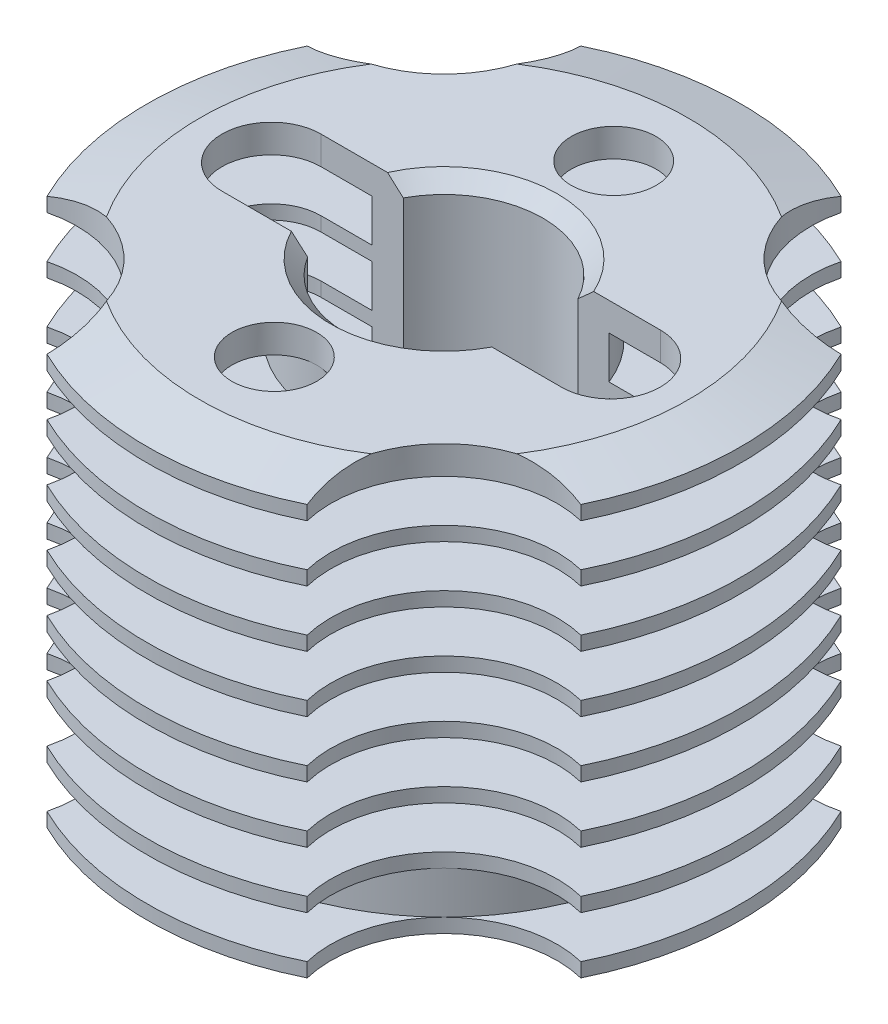
from build123d import *

# Parameters (mm, degrees)
SKETCH1_R            = 21
BOSS_EXTRUDE1_DEPTH  = 1
SKETCH2_R            = 16
BOSS_EXTRUDE2_DEPTH  = 3
SKETCH3_R            = 21
BOSS_EXTRUDE3_DEPTH  = 1
SKETCH4_R            = 9
BOSS_EXTRUDE4_DEPTH  = 3
SKETCH5_R            = 21
BOSS_EXTRUDE5_DEPTH  = 1
SKETCH6_R            = 9
BOSS_EXTRUDE6_DEPTH  = 3
SKETCH7_R            = 21
BOSS_EXTRUDE7_DEPTH  = 1
SKETCH8_R            = 9
BOSS_EXTRUDE8_DEPTH  = 3
SKETCH9_R            = 21
BOSS_EXTRUDE9_DEPTH  = 1
SKETCH10_R           = 9
BOSS_EXTRUDE10_DEPTH = 3
SKETCH11_R           = 21
BOSS_EXTRUDE11_DEPTH = 1
SKETCH12_R           = 9
BOSS_EXTRUDE12_DEPTH = 3
SKETCH13_R           = 21
BOSS_EXTRUDE13_DEPTH = 1
SKETCH14_R           = 9
BOSS_EXTRUDE14_DEPTH = 3
SKETCH15_R           = 21
BOSS_EXTRUDE15_DEPTH = 2
SKETCH16_R           = 7
CUT_EXTRUDE1_DEPTH   = 26
CUT_EXTRUDE2_DEPTH   = 25
SKETCH18_R           = 3
CUT_EXTRUDE3_DEPTH   = 24
SKETCH19_R           = 1.5
CUT_EXTRUDE4_DEPTH   = 39.820097888
CIRPATTERN1_COUNT    = 4
SKETCH23_R           = 7.5
BOSS_EXTRUDE16_DEPTH = 2
SKETCH24_R           = 2.5
CUT_EXTRUDE7_DEPTH   = 44.657759906
CHAMFER4_SIZE        = 1
CHAMFER5_SIZE        = 1
CHAMFER6_SIZE        = 1
CHAMFER6_SIZE2       = 3.732050808
SKETCH26_R           = 8
CUT_EXTRUDE8_DEPTH   = 44.657759906
CIRPATTERN2_COUNT    = 4


with BuildPart() as part:
    # Sketch1 → Boss-Extrude1 (new body)
    with BuildSketch(Plane(origin=(0, 0, 0), x_dir=(1, 0, 0), z_dir=(0, 1, 0))):
        with Locations(Location((0, 0, 0), (0, 0, 270))):
            Circle(SKETCH1_R)
    extrude(amount=BOSS_EXTRUDE1_DEPTH)

    # Sketch2 → Boss-Extrude2 (add)
    with BuildSketch(Plane(origin=(0, 1, 0), x_dir=(1, 0, 0), z_dir=(0, 1, 0))):
        with Locations(Location((0, 0, 0), (0, 0, 270))):
            Circle(SKETCH2_R)
    extrude(amount=BOSS_EXTRUDE2_DEPTH)

    # Sketch3 → Boss-Extrude3 (add)
    with BuildSketch(Plane(origin=(0, 4, 0), x_dir=(1, 0, 0), z_dir=(0, 1, 0))):
        with Locations(Location((0, 0, 0), (0, 0, 270))):
            Circle(SKETCH3_R)
    extrude(amount=BOSS_EXTRUDE3_DEPTH)

    # Sketch4 → Boss-Extrude4 (add)
    with BuildSketch(Plane(origin=(0, 5, 0), x_dir=(1, 0, 0), z_dir=(0, 1, 0))):
        with Locations(Location((0, 0, 0), (0, 0, 270))):
            Circle(SKETCH4_R)
    extrude(amount=BOSS_EXTRUDE4_DEPTH)

    # Sketch5 → Boss-Extrude5 (add)
    with BuildSketch(Plane(origin=(0, 8, 0), x_dir=(1, 0, 0), z_dir=(0, 1, 0))):
        with Locations(Location((0, 0, 0), (0, 0, 270))):
            Circle(SKETCH5_R)
    extrude(amount=BOSS_EXTRUDE5_DEPTH)

    # Sketch6 → Boss-Extrude6 (add)
    with BuildSketch(Plane(origin=(0, 9, 0), x_dir=(1, 0, 0), z_dir=(0, 1, 0))):
        with Locations(Location((0, 0, 0), (0, 0, 270))):
            Circle(SKETCH6_R)
    extrude(amount=BOSS_EXTRUDE6_DEPTH)

    # Sketch7 → Boss-Extrude7 (add)
    with BuildSketch(Plane(origin=(0, 12, 0), x_dir=(1, 0, 0), z_dir=(0, 1, 0))):
        with Locations(Location((0, 0, 0), (0, 0, 270))):
            Circle(SKETCH7_R)
    extrude(amount=BOSS_EXTRUDE7_DEPTH)

    # Sketch8 → Boss-Extrude8 (add)
    with BuildSketch(Plane(origin=(0, 13, 0), x_dir=(1, 0, 0), z_dir=(0, 1, 0))):
        with Locations(Location((0, 0, 0), (0, 0, 270))):
            Circle(SKETCH8_R)
    extrude(amount=BOSS_EXTRUDE8_DEPTH)

    # Sketch9 → Boss-Extrude9 (add)
    with BuildSketch(Plane(origin=(0, 16, 0), x_dir=(1, 0, 0), z_dir=(0, 1, 0))):
        with Locations(Location((0, 0, 0), (0, 0, 270))):
            Circle(SKETCH9_R)
    extrude(amount=BOSS_EXTRUDE9_DEPTH)

    # Sketch10 → Boss-Extrude10 (add)
    with BuildSketch(Plane(origin=(0, 17, 0), x_dir=(1, 0, 0), z_dir=(0, 1, 0))):
        with Locations(Location((0, 0, 0), (0, 0, 270))):
            Circle(SKETCH10_R)
    extrude(amount=BOSS_EXTRUDE10_DEPTH)

    # Sketch11 → Boss-Extrude11 (add)
    with BuildSketch(Plane(origin=(0, 20, 0), x_dir=(1, 0, 0), z_dir=(0, 1, 0))):
        with Locations(Location((0, 0, 0), (0, 0, 270))):
            Circle(SKETCH11_R)
    extrude(amount=BOSS_EXTRUDE11_DEPTH)

    # Sketch12 → Boss-Extrude12 (add)
    with BuildSketch(Plane(origin=(0, 21, 0), x_dir=(1, 0, 0), z_dir=(0, 1, 0))):
        with Locations(Location((0, 0, 0), (0, 0, 270))):
            Circle(SKETCH12_R)
    extrude(amount=BOSS_EXTRUDE12_DEPTH)

    # Sketch13 → Boss-Extrude13 (add)
    with BuildSketch(Plane(origin=(0, 24, 0), x_dir=(1, 0, 0), z_dir=(0, 1, 0))):
        with Locations(Location((0, 0, 0), (0, 0, 270))):
            Circle(SKETCH13_R)
    extrude(amount=BOSS_EXTRUDE13_DEPTH)

    # Sketch14 → Boss-Extrude14 (add)
    with BuildSketch(Plane(origin=(0, 25, 0), x_dir=(1, 0, 0), z_dir=(0, 1, 0))):
        with Locations(Location((0, 0, 0), (0, 0, 270))):
            Circle(SKETCH14_R)
    extrude(amount=BOSS_EXTRUDE14_DEPTH)

    # Sketch15 → Boss-Extrude15 (add)
    with BuildSketch(Plane(origin=(0, 28, 0), x_dir=(1, 0, 0), z_dir=(0, 1, 0))):
        with Locations(Location((0, 0, 0), (0, 0, 270))):
            Circle(SKETCH15_R)
    extrude(amount=BOSS_EXTRUDE15_DEPTH)

    # Sketch16 → Cut-Extrude1 (cut)
    with BuildSketch(Plane(origin=(0, 30, 0), x_dir=(1, 0, 0), z_dir=(0, 1, 0))):
        with Locations(Location((0, 0, 0), (0, 0, 270))):
            Circle(SKETCH16_R)
    extrude(amount=-CUT_EXTRUDE1_DEPTH, mode=Mode.SUBTRACT)

    # Sketch17 → Cut-Extrude2 (cut)
    with BuildSketch(Plane(origin=(0, 30, 0), x_dir=(1, 0, 0), z_dir=(0, 1, 0))):
        with BuildLine():
            Line((12, -3.702439688), (-12, -3.702439688))
            ThreePointArc((-12, -3.702439688), (-15.5, -0.202439688), (-12, 3.297560312))
            Line((-12, 3.297560312), (12, 3.297560312))
            ThreePointArc((12, 3.297560312), (15.5, -0.202439688), (12, -3.702439688))
        make_face()
    extrude(amount=-CUT_EXTRUDE2_DEPTH, mode=Mode.SUBTRACT)

    # Sketch18 → Cut-Extrude3 (cut)
    with BuildSketch(Plane(origin=(0, 30, 0), x_dir=(1, 0, 0), z_dir=(0, 1, 0))):
        with Locations(Location((0, 12, 0), (0, 0, 270))):
            Circle(SKETCH18_R)
        with Locations(Location((0, -12, 0), (0, 0, 270))):
            Circle(SKETCH18_R)
    extrude(amount=-CUT_EXTRUDE3_DEPTH, mode=Mode.SUBTRACT)

    # Sketch19 → Cut-Extrude4 (cut, through all)
    with BuildSketch(Plane(origin=(0, 5, 0), x_dir=(1, 0, 0), z_dir=(0, 1, 0))):
        with Locations(Location((0, -12, 0), (0, 0, 270))):
            Circle(SKETCH19_R)
    cut_extrude4 = extrude(amount=-CUT_EXTRUDE4_DEPTH, mode=Mode.SUBTRACT)

    # CirPattern1: Cut-Extrude4 ×4 about axis
    cirpattern1_axis = Axis((0, 0, 0), (0, 1, 0))
    for i in range(1, CIRPATTERN1_COUNT):
        add(cut_extrude4.rotate(cirpattern1_axis, i * 360 / CIRPATTERN1_COUNT), mode=Mode.SUBTRACT)

    # Sketch23 → Boss-Extrude16 (add)
    with BuildSketch(Plane.XZ):
        with Locations(Location((0, 0, 0), (0, 0, 90))):
            Circle(SKETCH23_R)
    extrude(amount=BOSS_EXTRUDE16_DEPTH)

    # Sketch24 → Cut-Extrude7 (cut, through all)
    with BuildSketch(Plane.XZ.offset(2)):
        with Locations(Location((0, 0, 0), (0, 0, 270))):
            Circle(SKETCH24_R)
    extrude(amount=-CUT_EXTRUDE7_DEPTH, mode=Mode.SUBTRACT)

    # Chamfer4
    chamfer4_edges = [part.edges().sort_by_distance(p)[0] for p in [
        (0, -2, 2.5),
    ]]
    chamfer(chamfer4_edges, length=CHAMFER4_SIZE)

    # Chamfer5
    chamfer5_edges = [part.edges().sort_by_distance(p)[0] for p in [
        (0, 30, -7),
        (-3.397272596, 30, 6.120338137),
    ]]
    chamfer(chamfer5_edges, length=CHAMFER5_SIZE)

    # Chamfer6
    chamfer6_edges = [part.edges().sort_by_distance(p)[0] for p in [
        (0, 30, -21),
    ]]
    chamfer6_side = [part.faces().sort_by_distance(p)[0] for p in [
        (0, 29, -21),
    ]]
    chamfer(chamfer6_edges, length=CHAMFER6_SIZE, length2=CHAMFER6_SIZE2, reference=chamfer6_side[0])

    # Sketch26 → Cut-Extrude8 (cut, through all)
    with BuildSketch(Plane(origin=(0, 30, 0), x_dir=(1, 0, 0), z_dir=(0, 1, 0))):
        with Locations((-16.970562748, 16.970562748)):
            Circle(SKETCH26_R)
    cut_extrude8 = extrude(amount=-CUT_EXTRUDE8_DEPTH, mode=Mode.SUBTRACT)

    # CirPattern2: Cut-Extrude8 ×4 about axis
    cirpattern2_axis = Axis((0, 0, 0), (0, 1, 0))
    for i in range(1, CIRPATTERN2_COUNT):
        add(cut_extrude8.rotate(cirpattern2_axis, i * 360 / CIRPATTERN2_COUNT), mode=Mode.SUBTRACT)


solid = part.part
